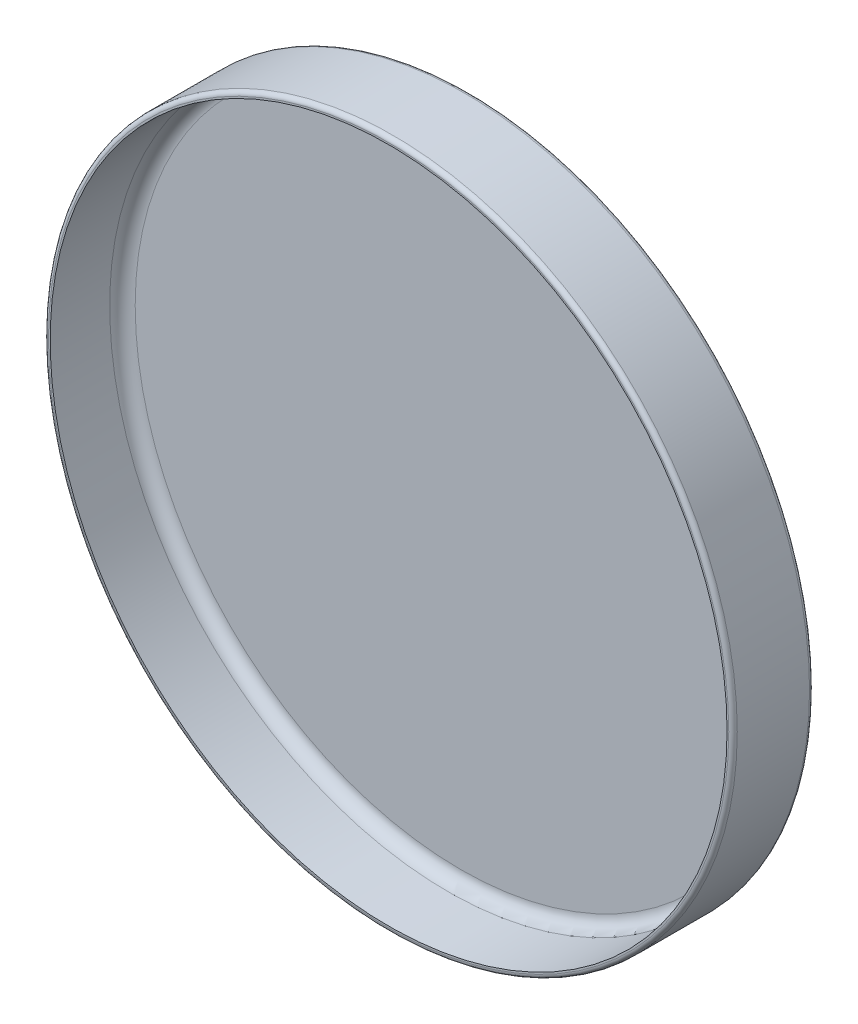
from build123d import *

# Parameters (mm, degrees)
SKETCH1_R           = 81
BOSS_EXTRUDE1_DEPTH = 2
BOSS_EXTRUDE2_START = 17
SKETCH1_3_R         = 81
SKETCH1_3_R_2       = 79.6
BOSS_EXTRUDE2_DEPTH = 17
FILLET3_R           = 1
FILLET4_R           = 1
FILLET5_R           = 3


with BuildPart() as part:
    # Sketch1 → Boss-Extrude1 (new body)
    with BuildSketch(Plane.XY):
        Circle(SKETCH1_R)
    extrude(amount=-BOSS_EXTRUDE1_DEPTH)

    # Sketch1<3> → Boss-Extrude2 (add)
    with BuildSketch(Plane.XY.offset(BOSS_EXTRUDE2_START)):
        Circle(SKETCH1_3_R)
        Circle(SKETCH1_3_R_2, mode=Mode.SUBTRACT)
    extrude(amount=-BOSS_EXTRUDE2_DEPTH)

    # Fillet3
    fillet3_edges = [part.edges().sort_by_distance(p)[0] for p in [
        (-81, 0, -2),
    ]]
    fillet(fillet3_edges, radius=FILLET3_R)

    # Fillet4
    fillet4_edges = [part.edges().sort_by_distance(p)[0] for p in [
        (-81, 0, 17),
    ]]
    fillet(fillet4_edges, radius=FILLET4_R)

    # Fillet5
    fillet5_edges = [part.edges().sort_by_distance(p)[0] for p in [
        (-79.6, 0, 0),
    ]]
    fillet(fillet5_edges, radius=FILLET5_R)


solid = part.part
